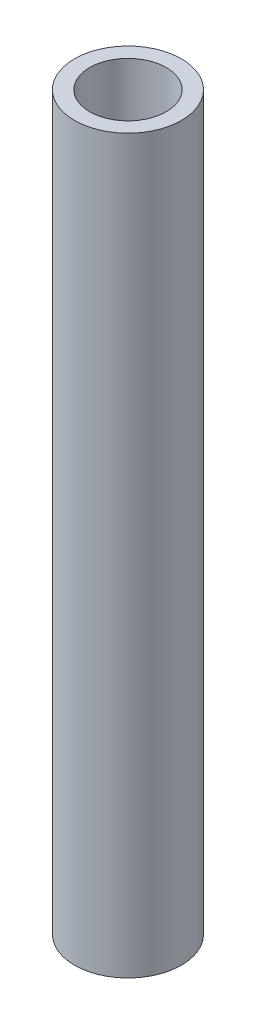
from build123d import *

# Parameters (mm, degrees)
SKETCH1_R           = 10.668
SKETCH1_R_2         = 7.6454
BOSS_EXTRUDE1_DEPTH = 146.05


with BuildPart() as part:
    # Sketch1 → Boss-Extrude1 (new body)
    with BuildSketch(Plane(origin=(0, 0, 0), x_dir=(1, 0, 0), z_dir=(0, 1, 0))):
        with Locations(Location((0, 0, 0), (0, 0, 270))):
            Circle(SKETCH1_R)
        with Locations(Location((0, 0, 0), (0, 0, 270))):
            Circle(SKETCH1_R_2, mode=Mode.SUBTRACT)
    extrude(amount=BOSS_EXTRUDE1_DEPTH)


solid = part.part
